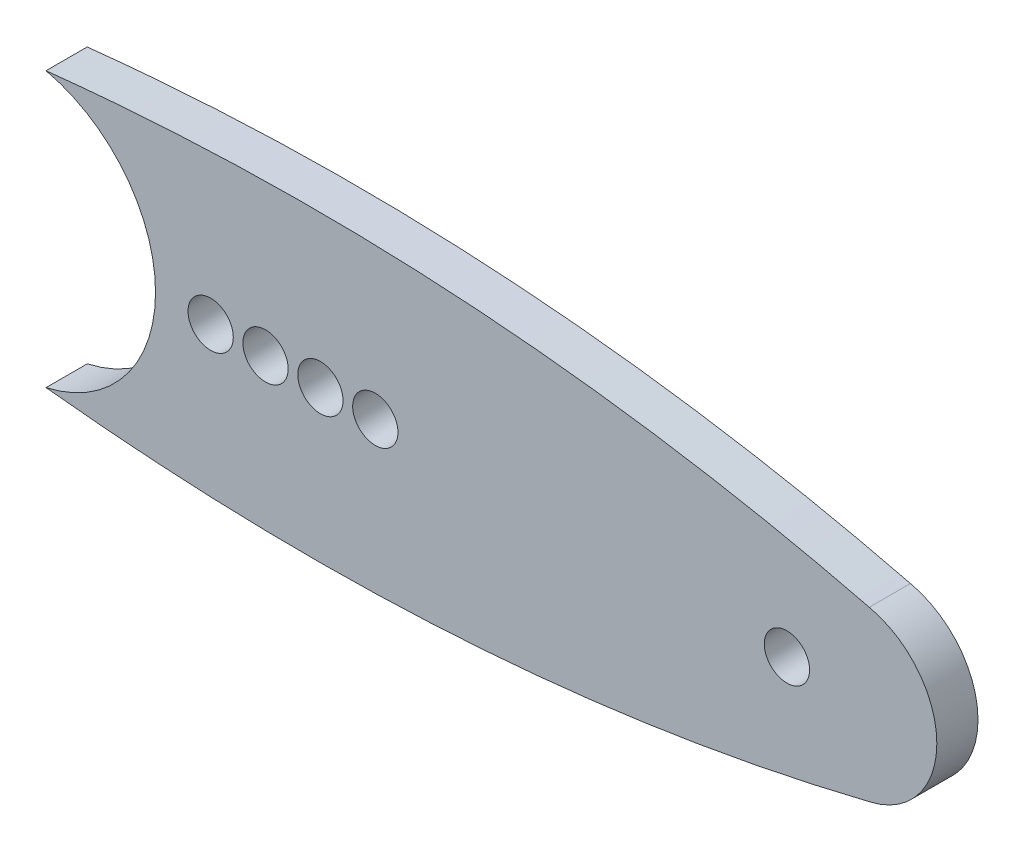
from build123d import *

# Parameters (mm, degrees)
SKETCH1_R           = 1.65
BOSS_EXTRUDE1_DEPTH = 3
SKETCH3_W           = 20
SKETCH3_H           = 3.526384588
BOSS_EXTRUDE2_DEPTH = 3


with BuildPart() as part:
    # Sketch1 → Boss-Extrude1 (new body)
    with BuildSketch(Plane.XY):
        with BuildLine():
            ThreePointArc((60, 6.136005382), (64.924934056, 0), (60, -6.136005382))
            add(Edge.make_bspline(
                [(0, -10), (30.892479525, -13.337059616), (60, -6.136005382)],
                knots=[0, 0, 0, 0.860506177, 0.860506177, 0.860506177], degree=2))
            ThreePointArc((0, -10), (7.982090261, 0), (0, 10))
            add(Edge.make_bspline(
                [(0, 10), (30.892479525, 13.337059616), (60, 6.136005382)],
                knots=[0, 0, 0, 0.860506177, 0.860506177, 0.860506177], degree=2))
        make_face()
        with Locations((12, 0)):
            Circle(SKETCH1_R, mode=Mode.SUBTRACT)
        with Locations((16, 0)):
            Circle(SKETCH1_R, mode=Mode.SUBTRACT)
        with Locations((20, 0)):
            Circle(SKETCH1_R, mode=Mode.SUBTRACT)
        with Locations((24, 0)):
            Circle(SKETCH1_R, mode=Mode.SUBTRACT)
        with Locations((54, 0)):
            Circle(SKETCH1_R, mode=Mode.SUBTRACT)
    extrude(amount=BOSS_EXTRUDE1_DEPTH)

    # Sketch3 → Boss-Extrude2 (add)
    with BuildSketch(Plane(origin=(0, 0, 0), x_dir=(-1, 0, 0), z_dir=(0, 0, -1))):
        with Locations((-39.233748341, 0)):
            Rectangle(SKETCH3_W, SKETCH3_H)
    extrude(amount=BOSS_EXTRUDE2_DEPTH)


solid = part.part
